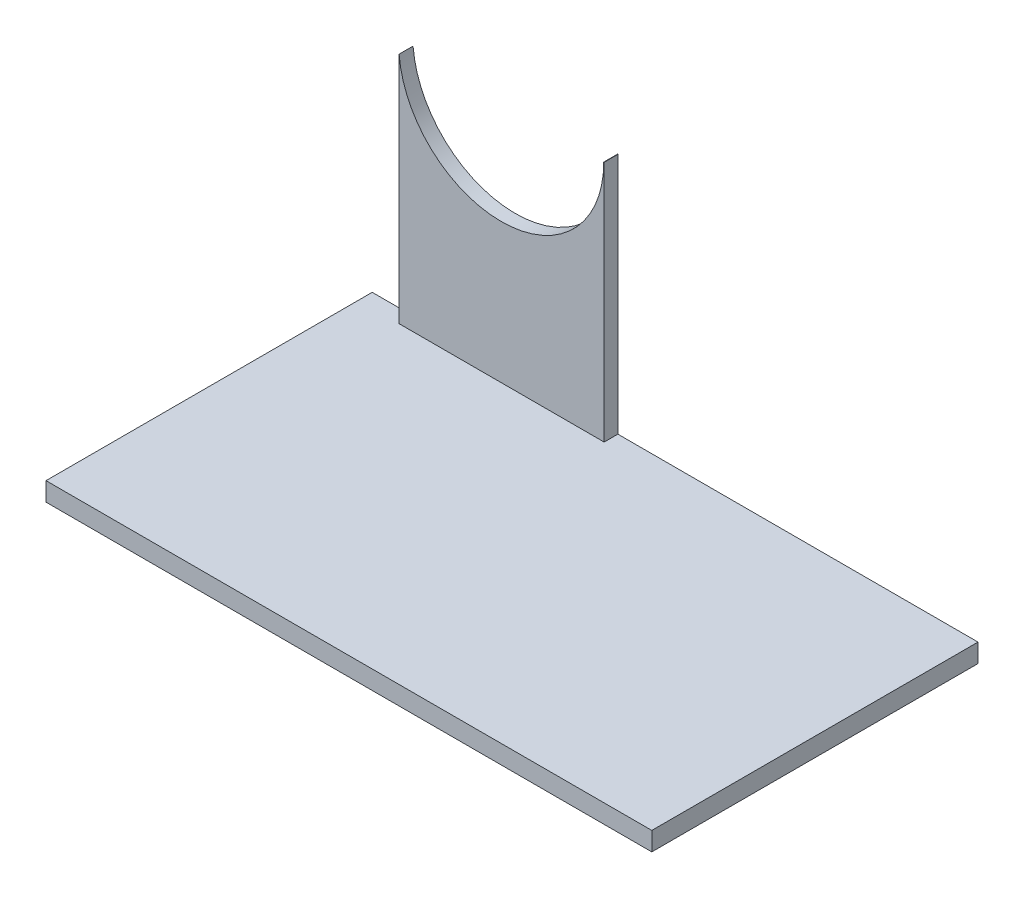
from build123d import *

# Parameters (mm, degrees)
SKETCH4_W            = 65
SKETCH4_H            = 35
BOSS_EXTRUDE1_DEPTH  = 2
SKETCH9_W            = 22.003076652
SKETCH9_H            = 1.5
BOSS_EXTRUDE15_DEPTH = 26
SKETCH11_R           = 11
CUT_EXTRUDE1_DEPTH   = 61.899561695


with BuildPart() as part:
    # Sketch4 → Boss-Extrude1 (new body)
    with BuildSketch(Plane(origin=(0, 0, 0), x_dir=(1, 0, 0), z_dir=(0, 1, 0))):
        with Locations((8.705128205, -1.91025641)):
            Rectangle(SKETCH4_W, SKETCH4_H)
    extrude(amount=BOSS_EXTRUDE1_DEPTH)

    # Sketch9 → Boss-Extrude15 (add)
    with BuildSketch(Plane(origin=(0, 2, 0), x_dir=(1, 0, 0), z_dir=(0, 1, 0))):
        with Locations((-8.435920152, 14.866790629)):
            Rectangle(SKETCH9_W, SKETCH9_H)
    extrude(amount=BOSS_EXTRUDE15_DEPTH)

    # Sketch11 → Cut-Extrude1 (cut, through all)
    with BuildSketch(Plane(origin=(0, 0, -15.616790629), x_dir=(-1, 0, 0), z_dir=(0, 0, -1))):
        with Locations((8.476636935, 27.972094264)):
            Circle(SKETCH11_R)
    extrude(amount=-CUT_EXTRUDE1_DEPTH, mode=Mode.SUBTRACT)


solid = part.part
